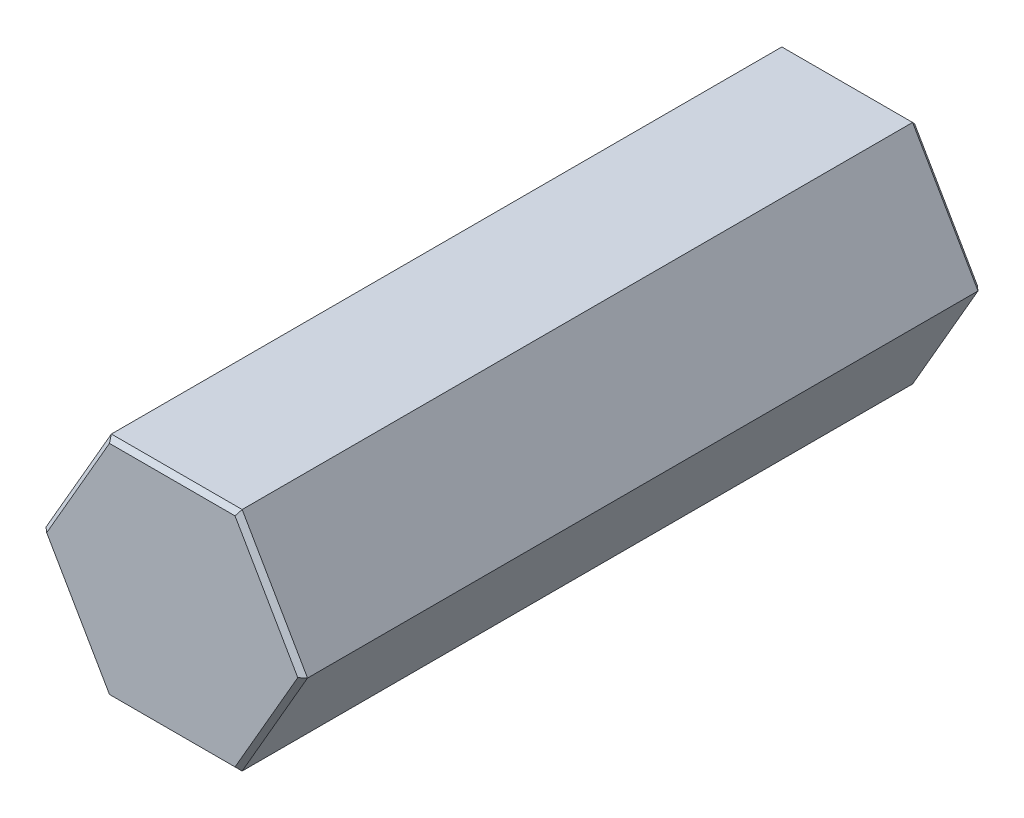
from build123d import *

# Parameters (mm, degrees)
BOSS_EXTRUDE1_DEPTH = 38.1
CHAMFER1_SIZE       = 0.254


with BuildPart() as part:
    # Sketch1 → Boss-Extrude1 (new body)
    with BuildSketch(Plane(origin=(0, 0, 0), x_dir=(-1, 0, 0), z_dir=(0, 0, -1))):
        Polygon((3.666174209, 6.35), (-3.666174209, 6.35), (-7.332348419, 0), (-3.666174209, -6.35), (3.666174209, -6.35), (7.332348419, 0), align=None)
    extrude(amount=-BOSS_EXTRUDE1_DEPTH)

    # Chamfer1
    chamfer1_edges = [part.edges().sort_by_distance(p)[0] for p in [
        (5.499261314, 3.175, 38.1),
        (5.499261314, -3.175, 38.1),
        (0, -6.35, 38.1),
        (-5.499261314, -3.175, 38.1),
        (-5.499261314, 3.175, 38.1),
        (-5.499261314, -3.175, 0),
        (0, -6.35, 0),
        (5.499261314, -3.175, 0),
        (5.499261314, 3.175, 0),
        (0, 6.35, 0),
        (-5.499261314, 3.175, 0),
        (0, 6.35, 38.1),
    ]]
    chamfer(chamfer1_edges, length=CHAMFER1_SIZE)


solid = part.part
